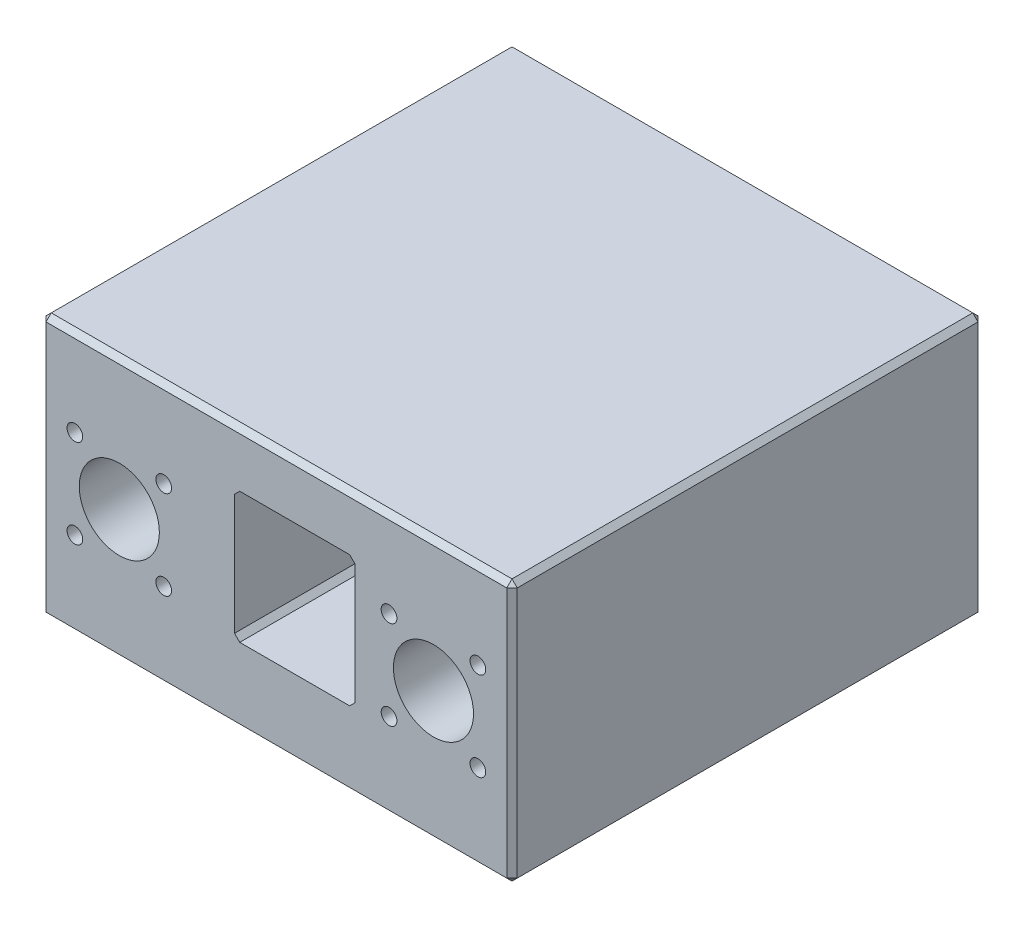
from build123d import *

# Parameters (mm, degrees)
SKETCH1_W           = 90
SKETCH1_H           = 50
BOSS_EXTRUDE1_DEPTH = 90
SKETCH2_R           = 7.65
CUT_EXTRUDE1_DEPTH  = 104.682206767
SKETCH3_R           = 2.25
CUT_EXTRUDE2_DEPTH  = 10
SKETCH4_R           = 1.5
CUT_EXTRUDE3_DEPTH  = 10
SKETCH5_R           = 1.5
CUT_EXTRUDE4_DEPTH  = 104.682206767
CHAMFER1_SIZE       = 1
SKETCH6_W           = 23
SKETCH6_H           = 25
CUT_EXTRUDE5_DEPTH  = 104.682206767
CHAMFER2_SIZE       = 1


with BuildPart() as part:
    # Sketch1 → Boss-Extrude1 (new body)
    with BuildSketch(Plane.XY):
        Rectangle(SKETCH1_W, SKETCH1_H)
    extrude(amount=BOSS_EXTRUDE1_DEPTH)

    # Sketch2 → Cut-Extrude1 (cut, through all)
    with BuildSketch(Plane.XY.offset(90)):
        with Locations((-30, 0)):
            Circle(SKETCH2_R)
        with Locations((30, 0)):
            Circle(SKETCH2_R)
    extrude(amount=-CUT_EXTRUDE1_DEPTH, mode=Mode.SUBTRACT)

    # Sketch3 → Cut-Extrude2 (cut)
    with BuildSketch(Plane.ZY.offset(45)):
        with Locations(Location((20, 20, 0), (0, 0, 270))):
            Circle(SKETCH3_R)
        with Locations(Location((70, 20, 0), (0, 0, 90))):
            Circle(SKETCH3_R)
    extrude(amount=-CUT_EXTRUDE2_DEPTH, mode=Mode.SUBTRACT)

    # Sketch4 → Cut-Extrude3 (cut)
    with BuildSketch(Plane.XZ.offset(25)):
        with Locations(Location((-38, 70, 0), (0, 0, 270))):
            Circle(SKETCH4_R)
        with Locations(Location((-38, 20, 0), (0, 0, 270))):
            Circle(SKETCH4_R)
    extrude(amount=-CUT_EXTRUDE3_DEPTH, mode=Mode.SUBTRACT)

    # Sketch5 → Cut-Extrude4 (cut, through all)
    with BuildSketch(Plane.XY.offset(90)):
        with Locations((-38.485281374, 8.485281374)):
            Circle(SKETCH5_R)
        with Locations((-21.514718626, 8.485281374)):
            Circle(SKETCH5_R)
        with Locations((-21.514718626, -8.485281374)):
            Circle(SKETCH5_R)
        with Locations((-38.485281374, -8.485281374)):
            Circle(SKETCH5_R)
        with Locations((38.485281374, -8.485281374)):
            Circle(SKETCH5_R)
        with Locations((21.514718626, -8.485281374)):
            Circle(SKETCH5_R)
        with Locations((21.514718626, 8.485281374)):
            Circle(SKETCH5_R)
        with Locations((38.485281374, 8.485281374)):
            Circle(SKETCH5_R)
    extrude(amount=-CUT_EXTRUDE4_DEPTH, mode=Mode.SUBTRACT)

    # Chamfer1
    chamfer1_edges = [part.edges().sort_by_distance(p)[0] for p in [
        (-45, 0, 90),
        (0, -25, 90),
        (45, 0, 90),
        (0, -25, 0),
        (-45, 0, 0),
        (0, 25, 0),
        (45, 0, 0),
        (45, -25, 45),
        (-45, -25, 45),
        (-45, 25, 45),
        (45, 25, 45),
        (0, 25, 90),
    ]]
    chamfer(chamfer1_edges, length=CHAMFER1_SIZE)

    # Sketch6 → Cut-Extrude5 (cut, through all)
    with BuildSketch(Plane.XY.offset(90)):
        with Locations((3.5, 2)):
            Rectangle(SKETCH6_W, SKETCH6_H)
    extrude(amount=-CUT_EXTRUDE5_DEPTH, mode=Mode.SUBTRACT)

    # Chamfer2
    chamfer2_edges = [part.edges().sort_by_distance(p)[0] for p in [
        (15, 14.5, 45),
        (15, -10.5, 45),
        (-8, -10.5, 45),
        (-8, 14.5, 45),
    ]]
    chamfer(chamfer2_edges, length=CHAMFER2_SIZE)


solid = part.part
